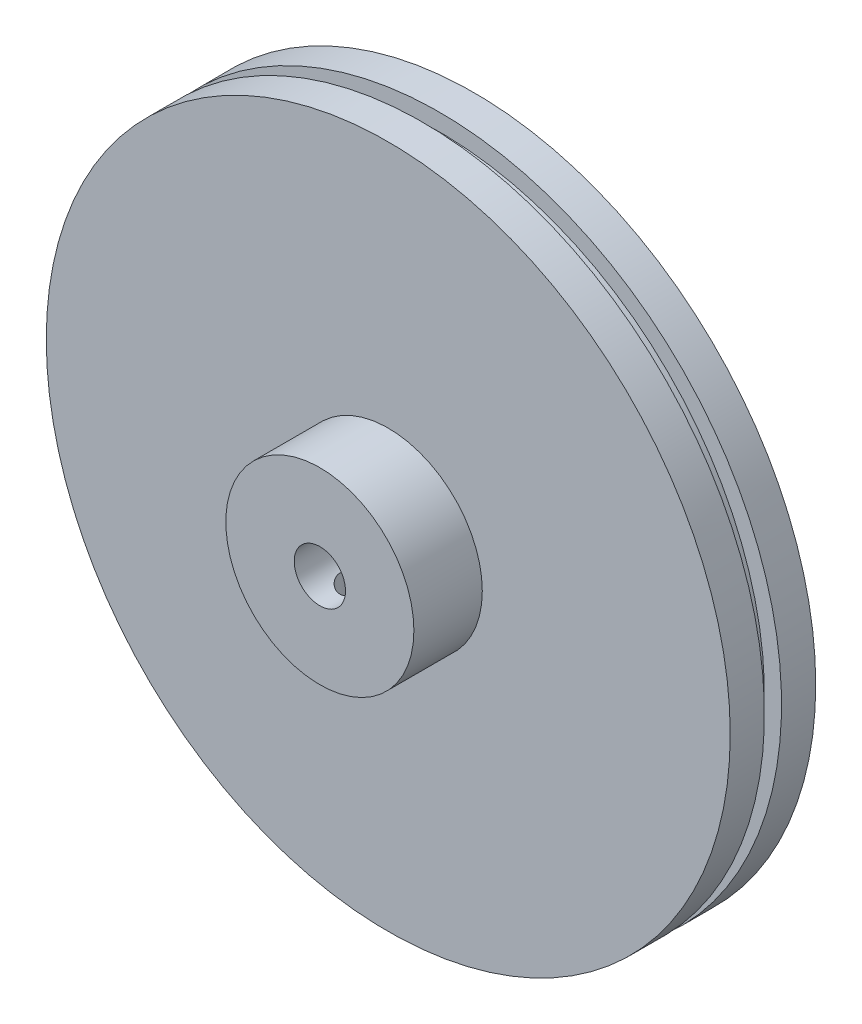
from build123d import *

# Parameters (mm, degrees)
SKETCH_1_R               = 40
EXTRUDE_1_DEPTH          = 10
SKETCH_2_R               = 11
EXTRUDE_2_DEPTH          = 8
SKETCH_3_R               = 3
CUT_EXTRUDE_1_DEPTH      = 60.363288319
M4X0_7_1_REACH           = 68.31
M4X0_7_1_BORE_R          = 1.65
CUT_EXTRUDE_2_DEPTH      = 1
CUT_EXTRUDE_2_DEPTH_BACK = 1
SKETCH_5_OUTSIDE_W       = 104.912
SKETCH_5_OUTSIDE_H       = 104.912
SKETCH_5_OUTSIDE_R       = 38


with BuildPart() as part:
    # ｽｹｯﾁ1 → ﾎﾞｽ - 押し出し1 (new body)
    with BuildSketch(Plane.XY):
        Circle(SKETCH_1_R)
    extrude(amount=EXTRUDE_1_DEPTH)

    # ｽｹｯﾁ2 → ﾎﾞｽ - 押し出し2 (add)
    with BuildSketch(Plane.XY.offset(10)):
        Circle(SKETCH_2_R)
    extrude(amount=EXTRUDE_2_DEPTH)

    # ｽｹｯﾁ3 → ｶｯﾄ - 押し出し1 (cut, through all)
    with BuildSketch(Plane.XY.offset(18)):
        Circle(SKETCH_3_R)
    extrude(amount=-CUT_EXTRUDE_1_DEPTH, mode=Mode.SUBTRACT)

    # M4x0.7 ねじ穴1 bore (on position points) → M4x0.7 ねじ穴1 (cut, up to next)
    with BuildSketch(Plane(origin=(0, -11, 14), x_dir=(-1, 0, 0), z_dir=(0, -1, 0)), mode=Mode.PRIVATE) as m4x0_7_1_sk1:
        Circle(M4X0_7_1_BORE_R)
    m4x0_7_1_tool1 = extrude(m4x0_7_1_sk1.sketch, amount=-M4X0_7_1_REACH, mode=Mode.PRIVATE) & part.part
    add(m4x0_7_1_tool1.solids().sort_by_distance((0, -11, 14))[0], mode=Mode.SUBTRACT)

    # ｽｹｯﾁ5 outside → ｶｯﾄ - 押し出し2 (cut, two sides: drawn at the far end of the back side and taken through both)
    with BuildSketch(Plane(origin=(0, 0, 5), x_dir=(-1, 0, 0), z_dir=(0, 0, -1)).offset(-CUT_EXTRUDE_2_DEPTH_BACK)):
        Rectangle(SKETCH_5_OUTSIDE_W, SKETCH_5_OUTSIDE_H)
        Circle(SKETCH_5_OUTSIDE_R, mode=Mode.SUBTRACT)
    extrude(amount=CUT_EXTRUDE_2_DEPTH + CUT_EXTRUDE_2_DEPTH_BACK, mode=Mode.SUBTRACT)


solid = part.part
